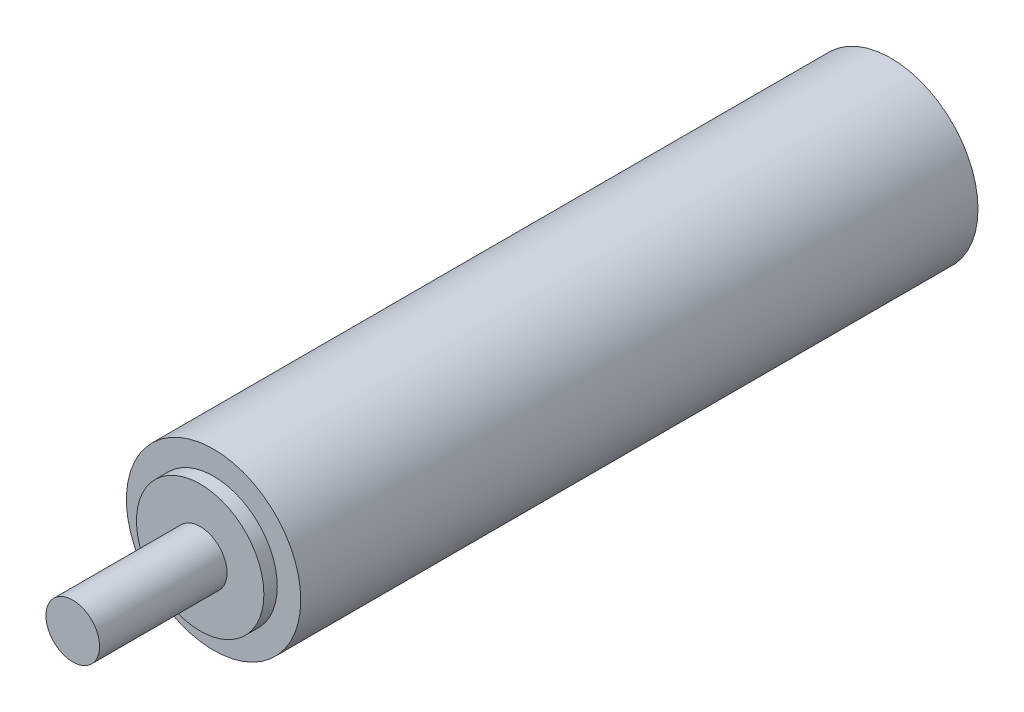
from build123d import *

# Parameters (mm, degrees)
SKETCH1_R           = 13
BOSS_EXTRUDE1_DEPTH = 101
SKETCH2_R           = 9.5
BOSS_EXTRUDE2_DEPTH = 2
SKETCH3_R           = 4
BOSS_EXTRUDE3_DEPTH = 19


with BuildPart() as part:
    # Sketch1 → Boss-Extrude1 (new body)
    with BuildSketch(Plane.XY):
        Circle(SKETCH1_R)
    extrude(amount=BOSS_EXTRUDE1_DEPTH)

    # Sketch2 → Boss-Extrude2 (add)
    with BuildSketch(Plane.XY.offset(101)):
        Circle(SKETCH2_R)
    extrude(amount=BOSS_EXTRUDE2_DEPTH)

    # Sketch3 → Boss-Extrude3 (add)
    with BuildSketch(Plane.XY.offset(103)):
        Circle(SKETCH3_R)
    extrude(amount=BOSS_EXTRUDE3_DEPTH)


solid = part.part
